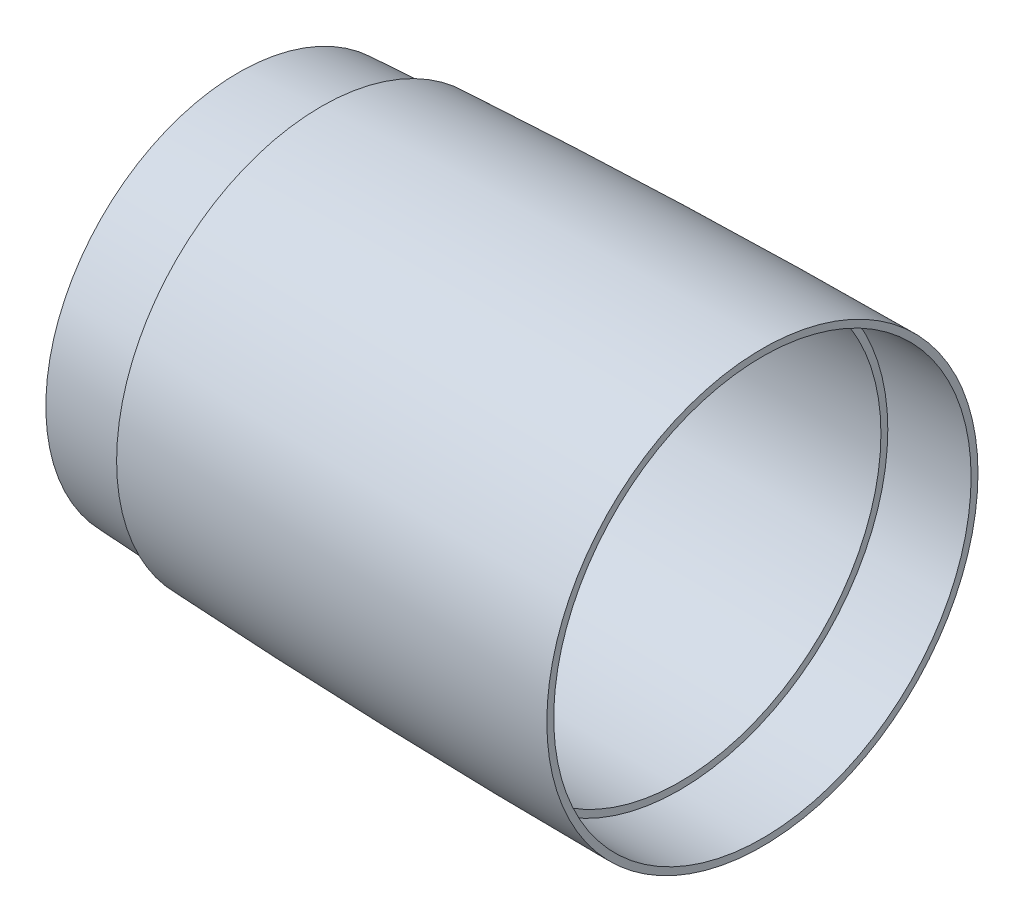
from build123d import *


with BuildPart() as part:
    # Sketch1 → Revolve1 (revolve)
    with BuildSketch(Plane.XY, mode=Mode.PRIVATE) as revolve1_sk:
        with BuildLine():
            Line((-10, 3632.986237243), (-10, 3635.486246708))
            ThreePointArc((-10, 3635.486246708), (-90.021811645, 3634.38527449), (-170, 3631.523130864))
            Line((-170, 3631.523130864), (-170, 3629.020391235))
            Line((-170, 3629.020391235), (-170, 3628.720062226))
            ThreePointArc((-170, 3628.720062226), (-185.001581242, 3627.986177611), (-200, 3627.190274855))
            Line((-200, 3627.190274855), (-200, 3624.986931011))
            ThreePointArc((-200, 3624.986931011), (-120.029176398, 3628.515295105), (-40, 3630.279637989))
            Line((-40, 3630.279637989), (-40, 3632.479771451))
            Line((-40, 3632.479771451), (-40, 3632.779789638))
            ThreePointArc((-40, 3632.779789638), (-25.000213102, 3632.913980449), (-10, 3632.986237243))
        make_face()
    revolve(revolve1_sk.sketch.rotate(Axis((0, 3557.296761587, 0), (-1, 0, 0)), 90), axis=Axis((0, 3557.296761587, 0), (-1, 0, 0)))


solid = part.part
